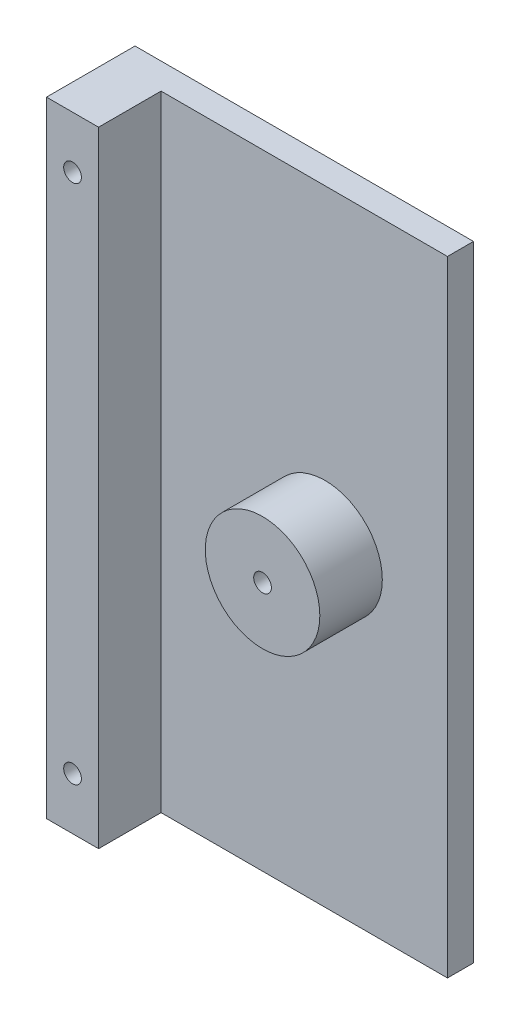
from build123d import *

# Parameters (mm, degrees)
SKETCH1_W           = 120
SKETCH1_H           = 65
BOSS_EXTRUDE1_DEPTH = 5
SKETCH2_W           = 10
SKETCH2_H           = 120
BOSS_EXTRUDE2_DEPTH = 12
SKETCH3_R           = 11
BOSS_EXTRUDE3_DEPTH = 12
SKETCH4_R           = 1.7
CUT_EXTRUDE1_DEPTH  = 22
SKETCH5_R           = 1.7
CUT_EXTRUDE2_DEPTH  = 17
CUT_EXTRUDE3_DEPTH  = 2.6


with BuildPart() as part:
    # Sketch1 → Boss-Extrude1 (new body)
    with BuildSketch(Plane(origin=(0, 0, 0), x_dir=(0, 1, 0), z_dir=(0, 0, 1))):
        Rectangle(SKETCH1_W, SKETCH1_H)
    extrude(amount=BOSS_EXTRUDE1_DEPTH)

    # Sketch2 → Boss-Extrude2 (add)
    with BuildSketch(Plane.XY.offset(5)):
        with Locations((-27.5, 0)):
            Rectangle(SKETCH2_W, SKETCH2_H)
    extrude(amount=BOSS_EXTRUDE2_DEPTH)

    # Sketch3 → Boss-Extrude3 (add)
    with BuildSketch(Plane.XY.offset(5)):
        with Locations((8.99, 0)):
            Circle(SKETCH3_R)
    extrude(amount=BOSS_EXTRUDE3_DEPTH)

    # Sketch4 → Cut-Extrude1 (cut)
    with BuildSketch(Plane.XY.offset(17)):
        with Locations((-27.5, 50)):
            Circle(SKETCH4_R)
        with Locations((-27.5, -50)):
            Circle(SKETCH4_R)
    extrude(amount=-CUT_EXTRUDE1_DEPTH, mode=Mode.SUBTRACT)

    # Sketch5 → Cut-Extrude2 (cut)
    with BuildSketch(Plane.XY.offset(17)):
        with Locations((8.99, 0)):
            Circle(SKETCH5_R)
    extrude(amount=-CUT_EXTRUDE2_DEPTH, mode=Mode.SUBTRACT)

    # Sketch6 → Cut-Extrude3 (cut)
    with BuildSketch(Plane(origin=(0, 0, 0), x_dir=(1, 0, 0), z_dir=(0, 0, -1))):
        Polygon((7.383808361, -2.87230716), (10.674395148, -2.827156342), (12.280586787, 0.045150817), (10.596191639, 2.87230716), (7.305604852, 2.827156342), (5.699413213, -0.045150817), align=None)
    extrude(amount=-CUT_EXTRUDE3_DEPTH, mode=Mode.SUBTRACT)


solid = part.part
